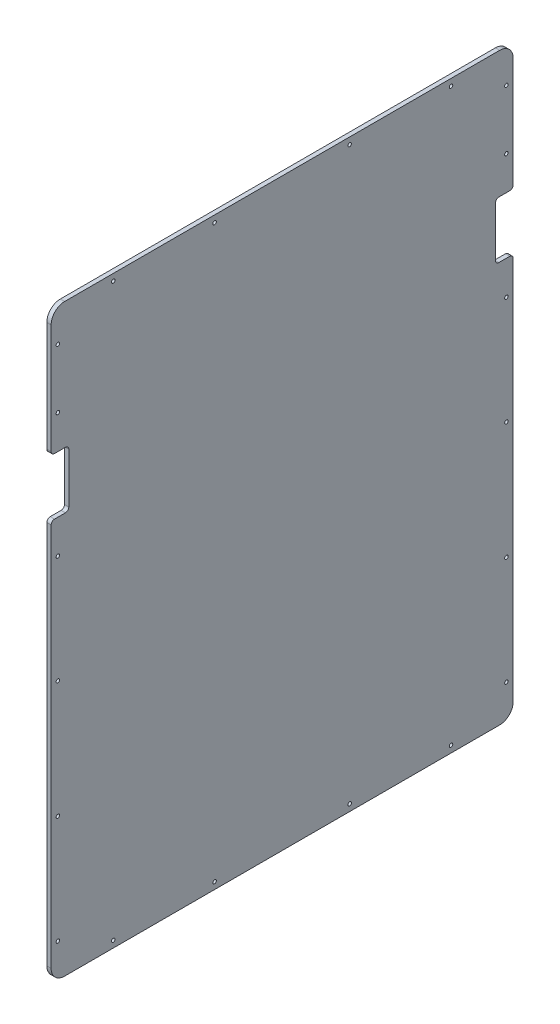
from build123d import *

# Parameters (mm, degrees)
SKETCH1_W           = 684
SKETCH1_H           = 865
BOSS_EXTRUDE1_DEPTH = 6.35
FILLET1_R           = 20
SKETCH3_W           = 26.15
SKETCH3_H           = 84
CUT_EXTRUDE2_DEPTH  = 552.416877235
FILLET2_R           = 5
SKETCH4_R           = 2.6
CUT_EXTRUDE3_DEPTH  = 552.416877235


with BuildPart() as part:
    # Sketch1 → Boss-Extrude1 (new body)
    with BuildSketch(Plane(origin=(0, 0, 0), x_dir=(0, 0, -1), z_dir=(1, 0, 0))):
        Rectangle(SKETCH1_W, SKETCH1_H)
    extrude(amount=BOSS_EXTRUDE1_DEPTH)

    # Fillet1
    fillet1_edges = [part.edges().sort_by_distance(p)[0] for p in [
        (3.175, -432.5, -342),
        (3.175, -432.5, 342),
        (3.175, 432.5, 342),
        (3.175, 432.5, -342),
    ]]
    fillet(fillet1_edges, radius=FILLET1_R)

    # Sketch3 → Cut-Extrude2 (cut, through all)
    with BuildSketch(Plane(origin=(6.35, 0, 0), x_dir=(0, 0, -1), z_dir=(1, 0, 0))):
        with Locations((-328.925, 203)):
            Rectangle(SKETCH3_W, SKETCH3_H)
    cut_extrude2 = extrude(amount=-CUT_EXTRUDE2_DEPTH, mode=Mode.SUBTRACT)

    # Mirror1: Cut-Extrude2 across plane
    add(cut_extrude2.mirror(Plane.XY), mode=Mode.SUBTRACT)

    # Fillet2
    fillet2_edges = [part.edges().sort_by_distance(p)[0] for p in [
        (3.175, 161, 342),
        (3.175, 245, 342),
        (3.175, 245, 315.85),
        (3.175, 161, 315.85),
        (3.175, 245, -342),
        (3.175, 161, -342),
        (3.175, 161, -315.85),
        (3.175, 245, -315.85),
    ]]
    fillet(fillet2_edges, radius=FILLET2_R)

    # Sketch4 → Cut-Extrude3 (cut, through all)
    with BuildSketch(Plane.ZY):
        with BuildLine():
            ThreePointArc((-97.4, 422.5), (-100, 425.1), (-102.6, 422.5))
            Line((-102.6, 422.5), (-97.4, 422.5))
        make_face()
        with BuildLine():
            Line((-97.4, 422.5), (-102.6, 422.5))
            ThreePointArc((-102.6, 422.5), (-100, 419.9), (-97.4, 422.5))
        make_face()
        with BuildLine():
            ThreePointArc((102.6, 422.5), (100, 425.1), (97.4, 422.5))
            Line((97.4, 422.5), (102.6, 422.5))
        make_face()
        with BuildLine():
            Line((102.6, 422.5), (97.4, 422.5))
            ThreePointArc((97.4, 422.5), (100, 419.9), (102.6, 422.5))
        make_face()
        with BuildLine():
            ThreePointArc((252.6, 422.5), (250, 425.1), (247.4, 422.5))
            Line((247.4, 422.5), (252.6, 422.5))
        make_face()
        with BuildLine():
            Line((252.6, 422.5), (247.4, 422.5))
            ThreePointArc((247.4, 422.5), (250, 419.9), (252.6, 422.5))
        make_face()
        with BuildLine():
            ThreePointArc((334.6, 382.5), (333.838477631, 384.338477631), (332, 385.1))
            Line((332, 385.1), (332, 379.9))
            ThreePointArc((332, 379.9), (333.838477631, 380.661522369), (334.6, 382.5))
        make_face()
        with BuildLine():
            Line((332, 379.9), (332, 385.1))
            ThreePointArc((332, 385.1), (329.4, 382.5), (332, 379.9))
        make_face()
        with BuildLine():
            ThreePointArc((332, -219.9), (329.4, -222.5), (332, -225.1))
            Line((332, -225.1), (332, -219.9))
        make_face()
        with BuildLine():
            Line((332, -219.9), (332, -225.1))
            ThreePointArc((332, -225.1), (333.838477631, -224.338477631), (334.6, -222.5))
            ThreePointArc((334.6, -222.5), (333.838477631, -220.661522369), (332, -219.9))
        make_face()
        with BuildLine():
            ThreePointArc((-247.4, -422.5), (-250, -419.9), (-252.6, -422.5))
            Line((-252.6, -422.5), (-247.4, -422.5))
        make_face()
        with BuildLine():
            Line((-247.4, -422.5), (-252.6, -422.5))
            ThreePointArc((-252.6, -422.5), (-250, -425.1), (-247.4, -422.5))
        make_face()
        with BuildLine():
            ThreePointArc((-329.4, -382.5), (-330.161522369, -380.661522369), (-332, -379.9))
            Line((-332, -379.9), (-332, -385.1))
            ThreePointArc((-332, -385.1), (-330.161522369, -384.338477631), (-329.4, -382.5))
        make_face()
        with BuildLine():
            Line((-332, -385.1), (-332, -379.9))
            ThreePointArc((-332, -379.9), (-334.6, -382.5), (-332, -385.1))
        make_face()
        with BuildLine():
            ThreePointArc((-329.4, -222.5), (-330.161522369, -220.661522369), (-332, -219.9))
            Line((-332, -219.9), (-332, -225.1))
            ThreePointArc((-332, -225.1), (-330.161522369, -224.338477631), (-329.4, -222.5))
        make_face()
        with BuildLine():
            Line((-332, -225.1), (-332, -219.9))
            ThreePointArc((-332, -219.9), (-334.6, -222.5), (-332, -225.1))
        make_face()
        with BuildLine():
            ThreePointArc((-329.4, -49), (-330.161522369, -47.161522369), (-332, -46.4))
            Line((-332, -46.4), (-332, -51.6))
            ThreePointArc((-332, -51.6), (-330.161522369, -50.838477631), (-329.4, -49))
        make_face()
        with BuildLine():
            Line((-332, -51.6), (-332, -46.4))
            ThreePointArc((-332, -46.4), (-334.6, -49), (-332, -51.6))
        make_face()
        with BuildLine():
            ThreePointArc((-329.4, 111), (-330.161522369, 112.838477631), (-332, 113.6))
            Line((-332, 113.6), (-332, 108.4))
            ThreePointArc((-332, 108.4), (-330.161522369, 109.161522369), (-329.4, 111))
        make_face()
        with BuildLine():
            Line((-332, 108.4), (-332, 113.6))
            ThreePointArc((-332, 113.6), (-334.6, 111), (-332, 108.4))
        make_face()
        with BuildLine():
            ThreePointArc((-332, 297.6), (-334.6, 295), (-332, 292.4))
            Line((-332, 292.4), (-332, 297.6))
        make_face()
        with BuildLine():
            Line((-332, 297.6), (-332, 292.4))
            ThreePointArc((-332, 292.4), (-330.161522369, 293.161522369), (-329.4, 295))
            ThreePointArc((-329.4, 295), (-330.161522369, 296.838477631), (-332, 297.6))
        make_face()
        with BuildLine():
            ThreePointArc((-332, 385.1), (-334.6, 382.5), (-332, 379.9))
            Line((-332, 379.9), (-332, 385.1))
        make_face()
        with BuildLine():
            Line((-332, 385.1), (-332, 379.9))
            ThreePointArc((-332, 379.9), (-330.161522369, 380.661522369), (-329.4, 382.5))
            ThreePointArc((-329.4, 382.5), (-330.161522369, 384.338477631), (-332, 385.1))
        make_face()
        with Locations((-250, 422.5)):
            Circle(SKETCH4_R)
        with Locations(Location((332, 295, 0), (0, 0, 180))):
            Circle(SKETCH4_R)
        with Locations(Location((332, 111, 0), (0, 0, 180))):
            Circle(SKETCH4_R)
        with Locations(Location((332, -49, 0), (0, 0, 180))):
            Circle(SKETCH4_R)
        with Locations(Location((332, -382.5, 0), (0, 0, 180))):
            Circle(SKETCH4_R)
        with Locations(Location((250, -422.5, 0), (0, 0, 180))):
            Circle(SKETCH4_R)
        with Locations(Location((100, -422.5, 0), (0, 0, 180))):
            Circle(SKETCH4_R)
        with Locations(Location((-100, -422.5, 0), (0, 0, 180))):
            Circle(SKETCH4_R)
    extrude(amount=-CUT_EXTRUDE3_DEPTH, mode=Mode.SUBTRACT)


solid = part.part
